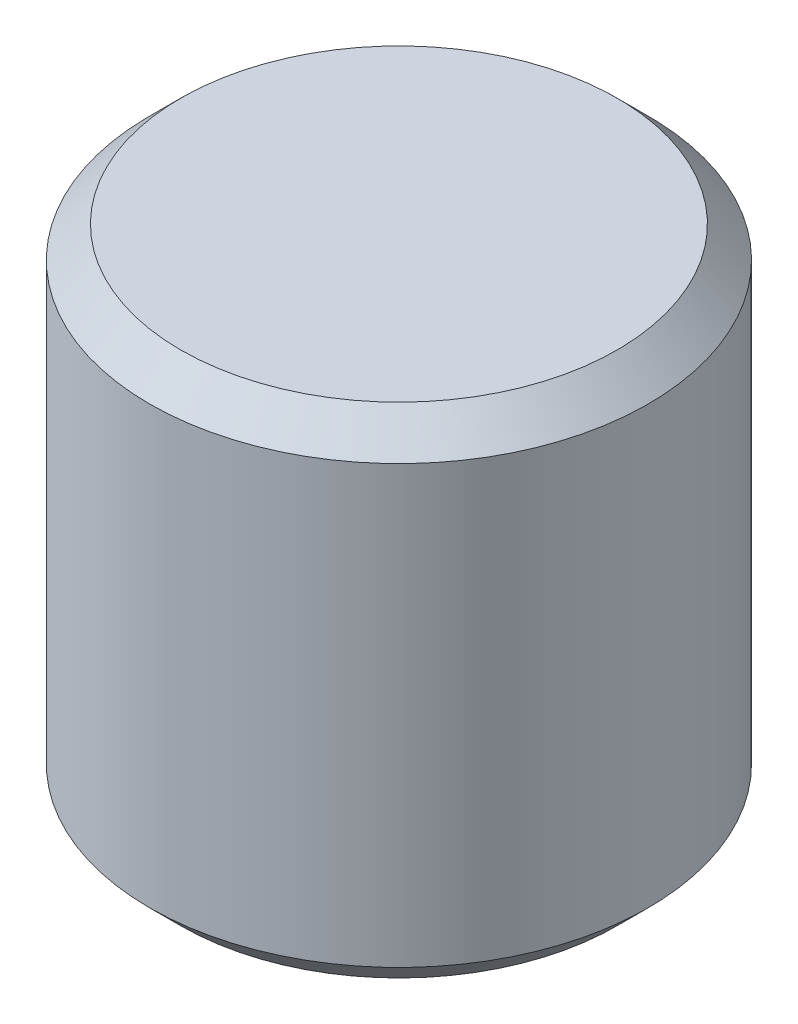
from build123d import *

# Parameters (mm, degrees)
SKETCH1_R           = 2
BOSS_EXTRUDE1_DEPTH = 4
CHAMFER1_SIZE       = 0.25


with BuildPart() as part:
    # Sketch1 → Boss-Extrude1 (new body)
    with BuildSketch(Plane(origin=(0, 0, 0), x_dir=(1, 0, 0), z_dir=(0, 1, 0))):
        with Locations(Location((0, 0, 0), (0, 0, 270))):
            Circle(SKETCH1_R)
    extrude(amount=BOSS_EXTRUDE1_DEPTH)

    # Chamfer1
    chamfer1_edges = [part.edges().sort_by_distance(p)[0] for p in [
        (0, 0, -2),
        (0, 4, -2),
    ]]
    chamfer(chamfer1_edges, length=CHAMFER1_SIZE)


solid = part.part
